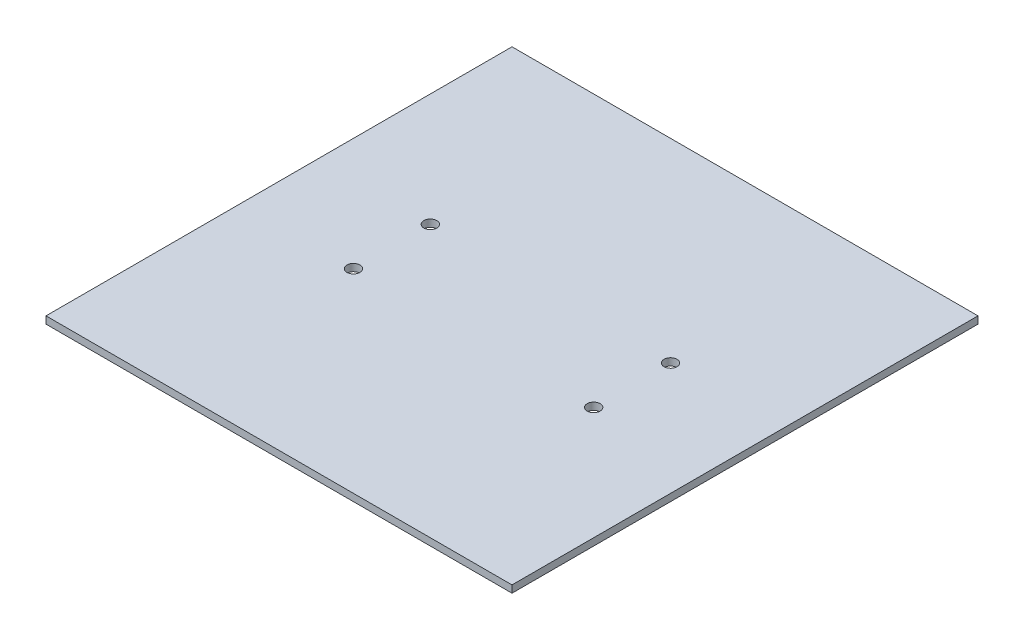
from build123d import *

# Parameters (mm, degrees)
SKETCH_1_W      = 194
SKETCH_1_H      = 194
SKETCH_1_R      = 2.695
EXTRUDE_1_DEPTH = 3


with BuildPart() as part:
    # 草图1 → 凸台-拉伸1 (new body)
    with BuildSketch(Plane(origin=(0, 0, 0), x_dir=(1, 0, 0), z_dir=(0, 1, 0))):
        Rectangle(SKETCH_1_W, SKETCH_1_H)
        with Locations(Location((50, 16, 0), (0, 0, 270))):
            Circle(SKETCH_1_R, mode=Mode.SUBTRACT)
        with Locations(Location((50, -16, 0), (0, 0, 270))):
            Circle(SKETCH_1_R, mode=Mode.SUBTRACT)
        with Locations(Location((-50, -16, 0), (0, 0, 90))):
            Circle(SKETCH_1_R, mode=Mode.SUBTRACT)
        with Locations(Location((-50, 16, 0), (0, 0, 90))):
            Circle(SKETCH_1_R, mode=Mode.SUBTRACT)
    extrude(amount=EXTRUDE_1_DEPTH)


solid = part.part
